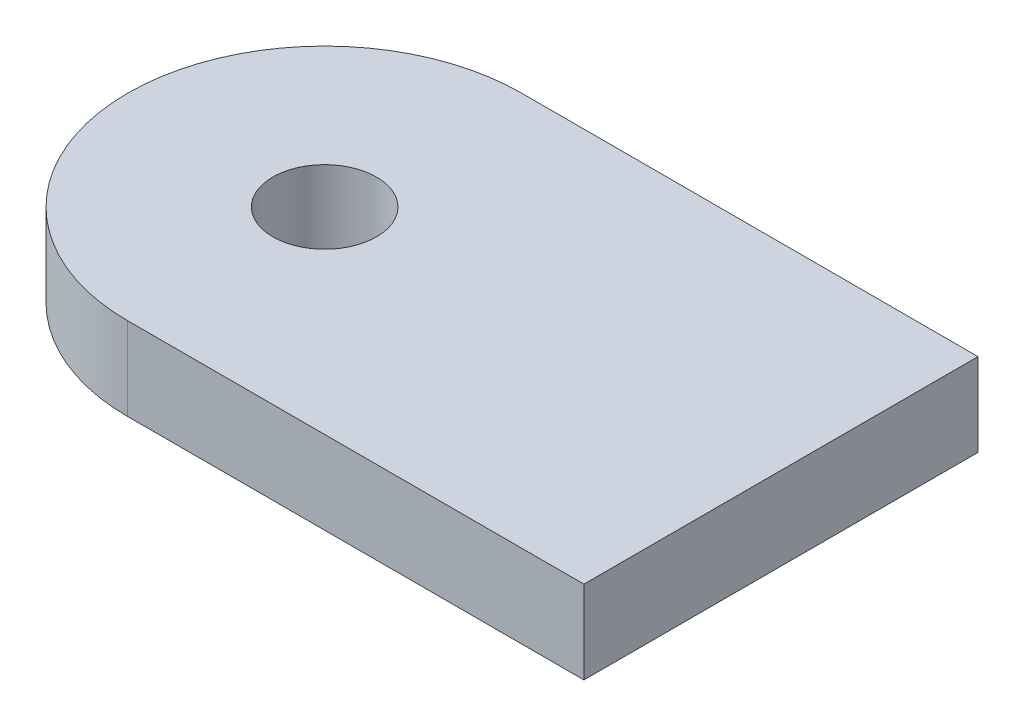
from build123d import *

# Parameters (mm, degrees)
SKETCH1_R           = 2.5
BOSS_EXTRUDE1_DEPTH = 4


with BuildPart() as part:
    # Sketch1 → Boss-Extrude1 (new body)
    with BuildSketch(Plane(origin=(0, 0, 0), x_dir=(1, 0, 0), z_dir=(0, 1, 0))):
        with BuildLine():
            Line((0, 0), (22, 0))
            Line((22, 0), (22, 19))
            Line((22, 19), (0, 19))
            ThreePointArc((0, 19), (-9.5, 9.5), (0, 0))
        make_face()
        with Locations(Location((0, 9.5, 0), (0, 0, 270))):
            Circle(SKETCH1_R, mode=Mode.SUBTRACT)
    extrude(amount=BOSS_EXTRUDE1_DEPTH)


solid = part.part
